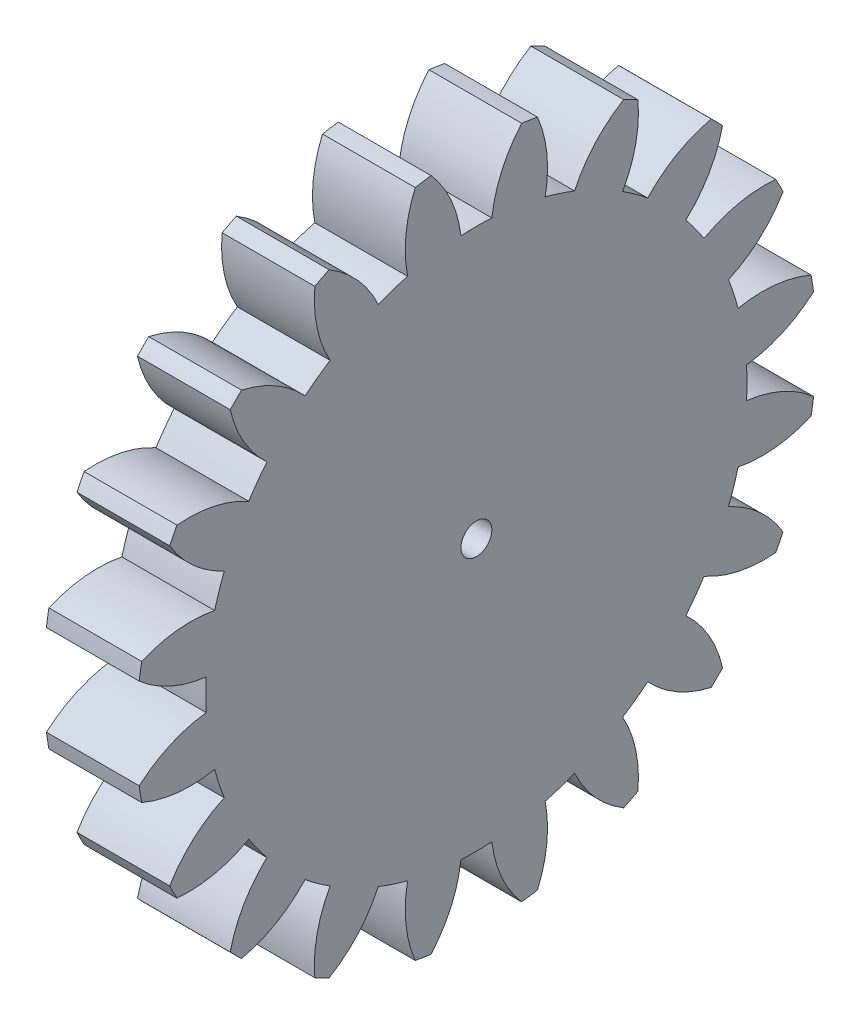
from build123d import *

# Parameters (mm, degrees)
BASPROSKE_W     = 3
BASPROSKE_H     = 11
TOOTHCUT_DEPTH  = 16.842979518
TEETHCUTS_COUNT = 20
TEETHCUTS_ANGLE = 342
BORSKE_R        = 0.5
BORE_DEPTH      = 50.0000508


with BuildPart() as part:
    # BasProSke → Base-Revolve (revolve)
    with BuildSketch(Plane(origin=(0, 0, 0), x_dir=(1, 0, 0), z_dir=(0, 1, 0)), mode=Mode.PRIVATE) as base_revolve_sk:
        with Locations((1.5, 5.5)):
            Rectangle(BASPROSKE_W, BASPROSKE_H)
    revolve(base_revolve_sk.sketch.rotate(Axis((-10, 0, 0), (1, 0, 0)), 180), axis=Axis((-10, 0, 0), (1, 0, 0)))

    # TooCutSke → ToothCut (cut, through all)
    with BuildSketch(Plane(origin=(0, 0, 0), x_dir=(0, 0, -1), z_dir=(1, 0, 0))):
        with BuildLine():
            ThreePointArc((0.499924007, 8.734705318), (0, 8.749), (-0.499924007, 8.734705318))
            ThreePointArc((-0.499924007, 8.734705318), (-0.824302243, 9.905497836), (-1.485192705, 10.924909509))
            ThreePointArc((-1.485192705, 10.924909509), (0, 11.0254), (1.485192705, 10.924909509))
            ThreePointArc((1.485192705, 10.924909509), (0.824302243, 9.905497836), (0.499924007, 8.734705318))
        make_face()
    toothcut = extrude(amount=TOOTHCUT_DEPTH, mode=Mode.SUBTRACT)

    # TeethCuts: ToothCut ×20 about axis
    teethcuts_axis = Axis((-10, 0, 0), (1, 0, 0))
    for i in range(1, TEETHCUTS_COUNT):
        add(toothcut.rotate(teethcuts_axis, i * TEETHCUTS_ANGLE / (TEETHCUTS_COUNT - 1)), mode=Mode.SUBTRACT)

    # BorSke → Bore (cut, symmetric)
    with BuildSketch(Plane(origin=(0, 0, 0), x_dir=(0, 0, -1), z_dir=(1, 0, 0))):
        with Locations(Location((0, 0, 0), (0, 0, 180))):
            Circle(BORSKE_R)
    extrude(amount=BORE_DEPTH, both=True, mode=Mode.SUBTRACT)


solid = part.part
